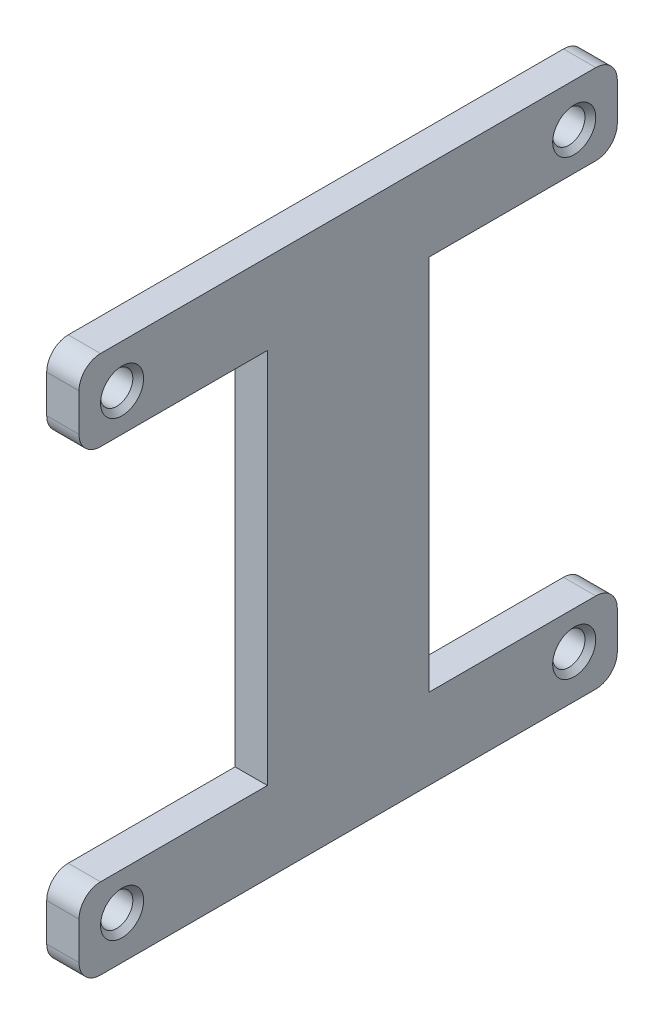
from build123d import *

# Parameters (mm, degrees)
EXTRUDE_1_DEPTH     = 3
SKETCH_2_R          = 1.5
CUT_EXTRUDE_1_DEPTH = 3
CHAMFER_1_SIZE      = 0.5
FILLET_1_R          = 2


with BuildPart() as part:
    # 草图1 → 凸台-拉伸1 (new body)
    with BuildSketch(Plane(origin=(0, 0, 0), x_dir=(0, 0, -1), z_dir=(1, 0, 0))):
        Polygon((25, 25), (-25, 25), (-25, 17.5), (-7.5, 17.5), (-7.5, -17.5), (-25, -17.5), (-25, -25), (25, -25), (25, -17.5), (7.5, -17.5), (7.5, 17.5), (25, 17.5), align=None)
    extrude(amount=EXTRUDE_1_DEPTH)

    # 草图2 → 切除-拉伸1 (cut)
    with BuildSketch(Plane(origin=(3, 0, 0), x_dir=(0, 0, -1), z_dir=(1, 0, 0))):
        with Locations((-21, 21)):
            Circle(SKETCH_2_R)
        with Locations((-21, -21)):
            Circle(SKETCH_2_R)
        with Locations(Location((21, -21, 0), (0, 0, 180))):
            Circle(SKETCH_2_R)
        with Locations(Location((21, 21, 0), (0, 0, 180))):
            Circle(SKETCH_2_R)
    extrude(amount=-CUT_EXTRUDE_1_DEPTH, mode=Mode.SUBTRACT)

    # 倒角1
    chamfer_1_edges = [part.edges().sort_by_distance(p)[0] for p in [
        (3, 21, -22.5),
        (3, -21, -22.5),
        (3, -21, 22.5),
        (3, 21, 22.5),
    ]]
    chamfer(chamfer_1_edges, length=CHAMFER_1_SIZE)

    # 圆角1
    fillet_1_edges = [part.edges().sort_by_distance(p)[0] for p in [
        (1.5, 25, 25),
        (1.5, 25, -25),
        (1.5, 17.5, -25),
        (1.5, -17.5, -25),
        (1.5, -25, -25),
        (1.5, -25, 25),
        (1.5, -17.5, 25),
        (1.5, 17.5, 25),
    ]]
    fillet(fillet_1_edges, radius=FILLET_1_R)


solid = part.part
